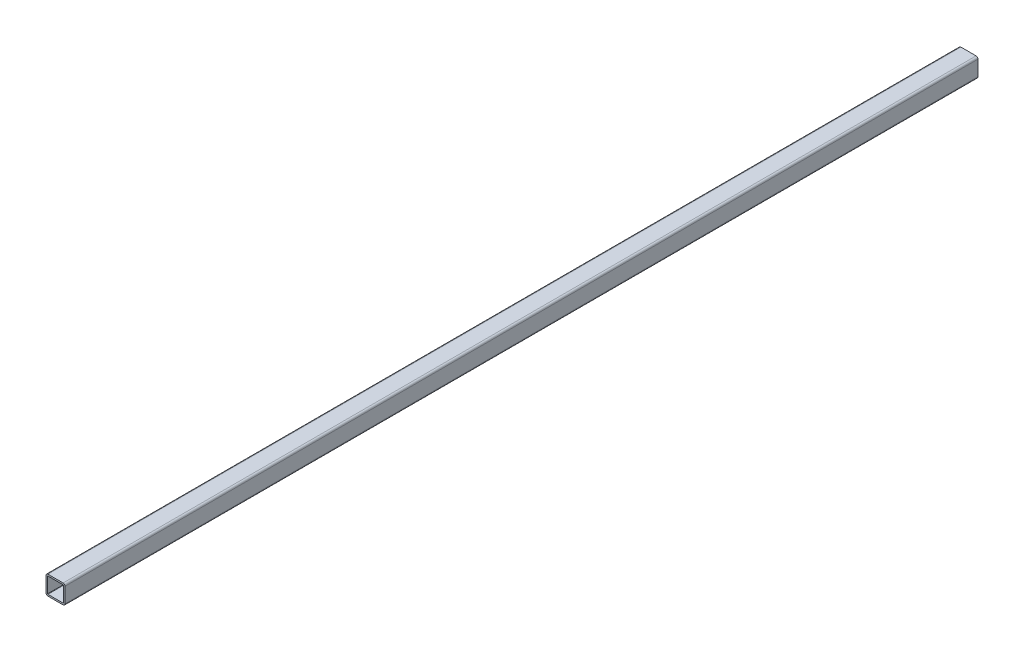
from build123d import *

# Parameters (mm, degrees)
SKETCH2_W           = 19.05
SKETCH2_H           = 19.05
SKETCH2_W_2         = 15.875
SKETCH2_H_2         = 15.875
BOSS_EXTRUDE1_DEPTH = 457.2
FILLET1_R           = 1.905
FILLET2_R           = 0.3175


with BuildPart() as part:
    # Sketch2 → Boss-Extrude1 (new, symmetric)
    with BuildSketch(Plane.XY):
        Rectangle(SKETCH2_W, SKETCH2_H)
        Rectangle(SKETCH2_W_2, SKETCH2_H_2, mode=Mode.SUBTRACT)
    extrude(amount=BOSS_EXTRUDE1_DEPTH, both=True)

    # Fillet1
    fillet1_edges = [part.edges().sort_by_distance(p)[0] for p in [
        (-9.525, -9.525, 0),
        (-9.525, 9.525, 0),
        (9.525, 9.525, 0),
        (9.525, -9.525, 0),
    ]]
    fillet(fillet1_edges, radius=FILLET1_R)

    # Fillet2
    fillet2_edges = [part.edges().sort_by_distance(p)[0] for p in [
        (-7.9375, -7.9375, 0),
        (7.9375, -7.9375, 0),
        (7.9375, 7.9375, 0),
        (-7.9375, 7.9375, 0),
    ]]
    fillet(fillet2_edges, radius=FILLET2_R)


solid = part.part
